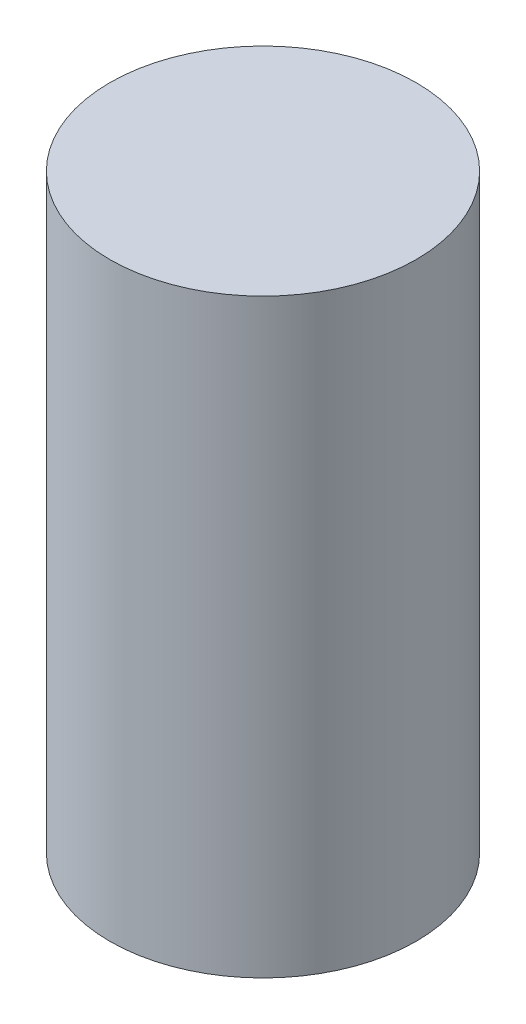
from build123d import *

# Parameters (mm, degrees)
SKETCH1_R           = 27.5
BOSS_EXTRUDE1_DEPTH = 106


with BuildPart() as part:
    # Sketch1 → Boss-Extrude1 (new body)
    with BuildSketch(Plane(origin=(0, 0, 0), x_dir=(1, 0, 0), z_dir=(0, 1, 0))):
        with Locations(Location((0, 0, 0), (0, 0, 270))):
            Circle(SKETCH1_R)
    extrude(amount=BOSS_EXTRUDE1_DEPTH)


solid = part.part
